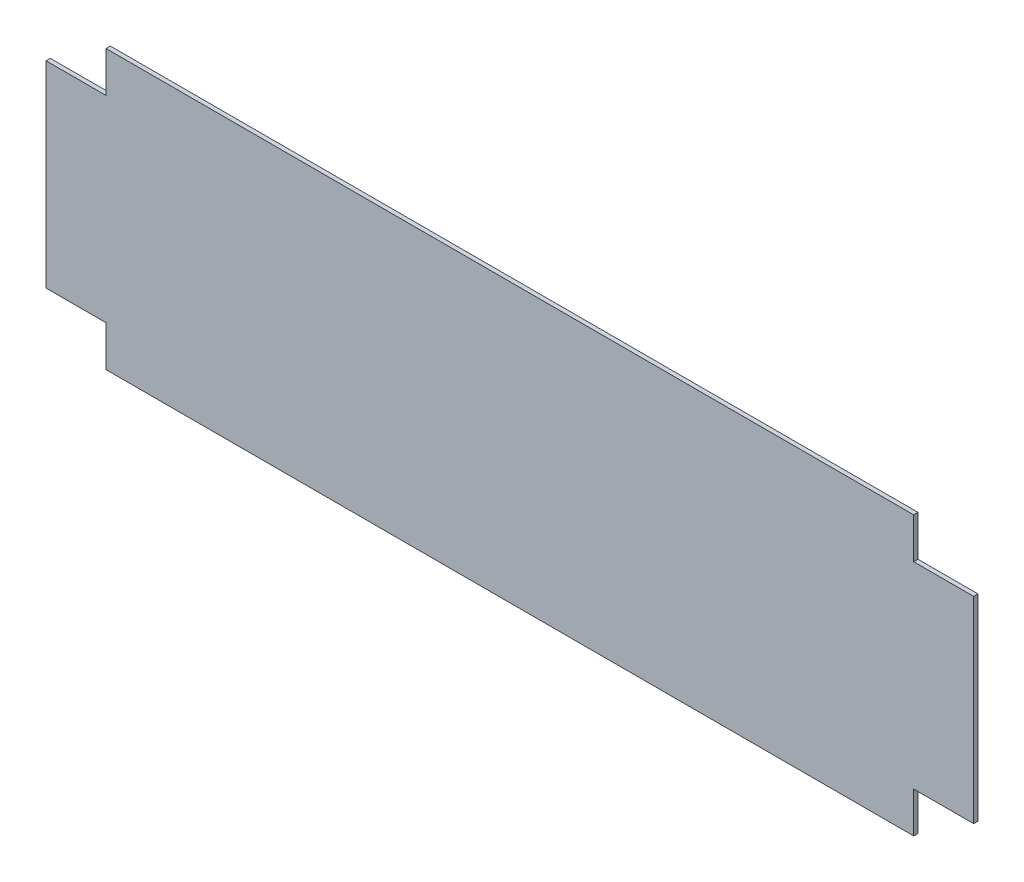
from build123d import *

# Parameters (mm, degrees)
BOSS_EXTRUDE1_DEPTH = 2


with BuildPart() as part:
    # Sketch1 → Boss-Extrude1 (new body)
    with BuildSketch(Plane.XY):
        Polygon((-11.525, 92.097410502), (16.552067079, 92.097410502), (16.552067079, 111.10100566), (394.397932921, 111.10100566), (394.397932921, 92.097410502), (422.475, 92.097410502), (422.475, 0), (394.397932921, 0), (394.397932921, -19.003595157), (16.552067079, -19.003595157), (16.552067079, 0), (-11.525, 0), align=None)
    extrude(amount=BOSS_EXTRUDE1_DEPTH)


solid = part.part
